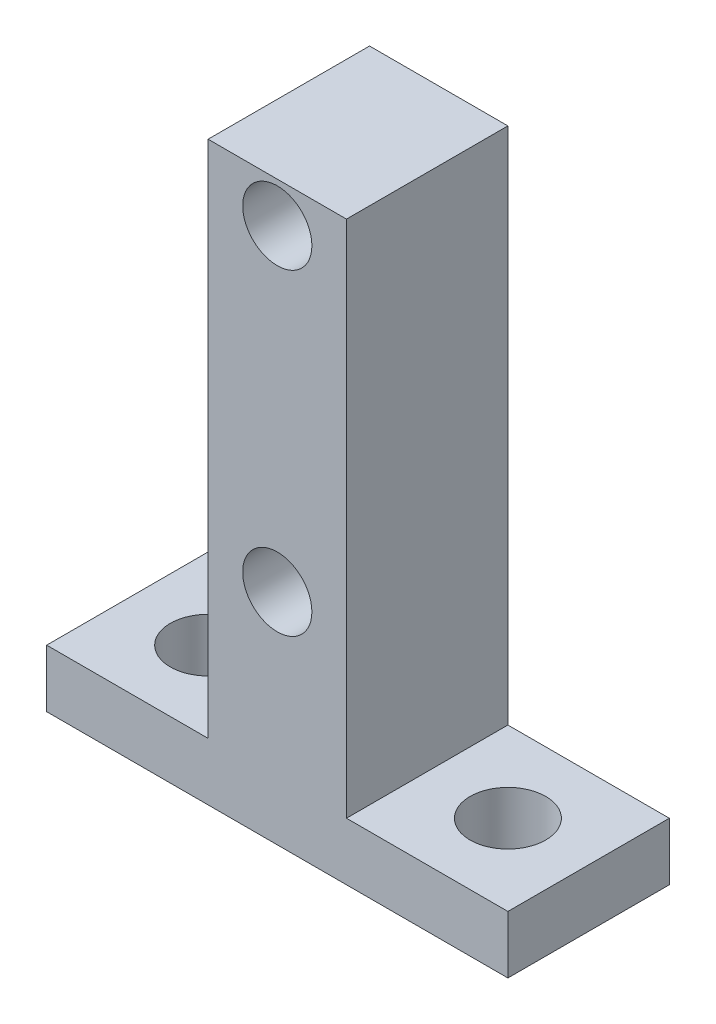
from build123d import *

# Parameters (mm, degrees)
SKETCH1_R                = 2.38125
BOSS_EXTRUDE1_DEPTH      = 38.1
FILLET1_R                = 6.35
SKETCH3_W                = 38.1
SKETCH3_H                = 6.35
BOSS_EXTRUDE2_DEPTH      = 12.7
SKETCH2_W                = 7.62
SKETCH2_H                = 8.89
CUT_EXTRUDE7_DEPTH       = 66.019560197
BOSS_EXTRUDE5_DEPTH      = 22.225
BOSS_EXTRUDE5_DEPTH_BACK = 9.525
SKETCH10_W               = 7.62
SKETCH10_H               = 8.89
CUT_EXTRUDE1_DEPTH       = 62.376176621
CUT_EXTRUDE1_DEPTH_BACK  = 62.376176621
SKETCH5_R                = 1.905
SKETCH6_W                = 8.89
SKETCH6_H                = 8.89
BOSS_EXTRUDE4_DEPTH      = 3.175
CUT_EXTRUDE2_DEPTH       = 71.485759779
CUT_EXTRUDE2_DEPTH_BACK  = 71.485759779
SKETCH7_R                = 2.0828
CUT_EXTRUDE8_DEPTH       = 13.335
CUT_EXTRUDE9_DEPTH       = 62.376176621
SKETCH12_W               = 15.875
SKETCH12_H               = 6.35
CUT_EXTRUDE10_DEPTH      = 40.128574278


with BuildPart() as part:
    # Sketch1 → Boss-Extrude1 (new body)
    with BuildSketch(Plane.XY):
        with BuildLine():
            Line((-37.385625, -8.255), (-37.385625, -3.175))
            Line((-37.385625, -3.175), (-37.385625, 3.175))
            Line((-37.385625, 3.175), (37.385625, 3.175))
            Line((37.385625, 3.175), (37.385625, -3.175))
            Line((37.385625, -3.175), (-27.543125, -3.175))
            Line((-27.543125, -3.175), (-27.543125, -8.255))
            ThreePointArc((-27.543125, -8.255), (-32.464375, -13.17625), (-37.385625, -8.255))
        make_face()
        with Locations(Location((-32.464375, -8.255, 0), (0, 0, 180))):
            Circle(SKETCH1_R, mode=Mode.SUBTRACT)
    extrude(amount=BOSS_EXTRUDE1_DEPTH)

    # Fillet1
    fillet1_edges = [part.edges().sort_by_distance(p)[0] for p in [
        (-37.385625, 3.175, 19.05),
    ]]
    fillet(fillet1_edges, radius=FILLET1_R)

    # Sketch3 → Boss-Extrude2 (add)
    with BuildSketch(Plane(origin=(37.385625, 0, 0), x_dir=(0, 0, -1), z_dir=(1, 0, 0))):
        with Locations((-19.05, 0)):
            Rectangle(SKETCH3_W, SKETCH3_H)
    extrude(amount=BOSS_EXTRUDE2_DEPTH)

    # Sketch2 → Cut-Extrude7 (cut, through all)
    with BuildSketch(Plane(origin=(0, 3.175, 0), x_dir=(1, 0, 0), z_dir=(0, 1, 0))):
        with Locations((17.541875, -20.32)):
            Rectangle(SKETCH2_W, SKETCH2_H)
    extrude(amount=-CUT_EXTRUDE7_DEPTH, mode=Mode.SUBTRACT)

    # Sketch10 → Boss-Extrude5 (add, two sides: drawn at the far end of the back side and taken through both)
    with BuildSketch(Plane(origin=(0, 3.175, 0), x_dir=(1, 0, 0), z_dir=(0, 1, 0)).offset(-BOSS_EXTRUDE5_DEPTH_BACK)):
        with Locations((17.541875, -20.32)):
            Rectangle(SKETCH10_W, SKETCH10_H)
    extrude(amount=BOSS_EXTRUDE5_DEPTH + BOSS_EXTRUDE5_DEPTH_BACK)

    # Sketch5 → Cut-Extrude1 (cut, two sides: drawn at the far end of the back side and taken through both)
    with BuildSketch(Plane.XY.offset(24.765).offset(-CUT_EXTRUDE1_DEPTH_BACK)):
        with Locations((17.541875, 5.715)):
            Circle(SKETCH5_R)
        with Locations((17.541875, 23.1775)):
            Circle(SKETCH5_R)
    extrude(amount=CUT_EXTRUDE1_DEPTH + CUT_EXTRUDE1_DEPTH_BACK, mode=Mode.SUBTRACT)

    # Sketch6 → Boss-Extrude4 (add)
    with BuildSketch(Plane(origin=(0, -3.175, 0), x_dir=(1, 0, 0), z_dir=(0, 1, 0))):
        with Locations((9.286875, -20.32)):
            Rectangle(SKETCH6_W, SKETCH6_H)
        with Locations((25.796875, -20.32)):
            Rectangle(SKETCH6_W, SKETCH6_H)
    extrude(amount=-BOSS_EXTRUDE4_DEPTH)

    # Sketch7 → Cut-Extrude2 (cut, two sides: drawn at the far end of the back side and taken through both)
    with BuildSketch(Plane(origin=(0, -6.35, 0), x_dir=(-1, 0, 0), z_dir=(0, -1, 0)).offset(-CUT_EXTRUDE2_DEPTH_BACK)):
        with Locations(Location((-9.286875, -20.32, 0), (0, 0, 90))):
            Circle(SKETCH7_R)
        with Locations(Location((-25.796875, -20.32, 0), (0, 0, 90))):
            Circle(SKETCH7_R)
    extrude(amount=CUT_EXTRUDE2_DEPTH + CUT_EXTRUDE2_DEPTH_BACK, mode=Mode.SUBTRACT)

    # Sketch9 → Cut-Extrude8 (cut)
    with BuildSketch(Plane.XY.offset(38.1)):
        with BuildLine():
            Line((50.085625, 3.175), (50.085625, -3.175))
            Line((50.085625, -3.175), (-27.543125, -3.175))
            Line((-27.543125, -3.175), (-27.543125, -8.255))
            ThreePointArc((-27.543125, -8.255), (-32.464375, -13.17625), (-37.385625, -8.255))
            Line((-37.385625, -8.255), (-37.385625, -3.175))
            ThreePointArc((-37.385625, -3.175), (-35.525753061, 1.315128061), (-31.035625, 3.175))
            Line((-31.035625, 3.175), (50.085625, 3.175))
        make_face()
    extrude(amount=-CUT_EXTRUDE8_DEPTH, mode=Mode.SUBTRACT)

    # Sketch11 → Cut-Extrude9 (cut, through all)
    with BuildSketch(Plane.XY.offset(24.765)):
        Polygon((21.351875, 3.175), (21.351875, -3.175), (30.241875, -3.175), (54.982981917, -12.803682108), (51.254802373, 20.663231938), align=None)
        Polygon((4.841875, -3.175), (13.731875, -3.175), (13.731875, 3.175), (-41.256071428, 5.663811912), (-38.308208532, -22.514289292), align=None)
    extrude(amount=-CUT_EXTRUDE9_DEPTH, mode=Mode.SUBTRACT)

    # Sketch12 → Cut-Extrude10 (cut, through all)
    with BuildSketch(Plane(origin=(21.351875, 0, 0), x_dir=(0, 0, -1), z_dir=(1, 0, 0))):
        with Locations((-7.9375, 0)):
            Rectangle(SKETCH12_W, SKETCH12_H)
    extrude(amount=-CUT_EXTRUDE10_DEPTH, mode=Mode.SUBTRACT)


solid = part.part
